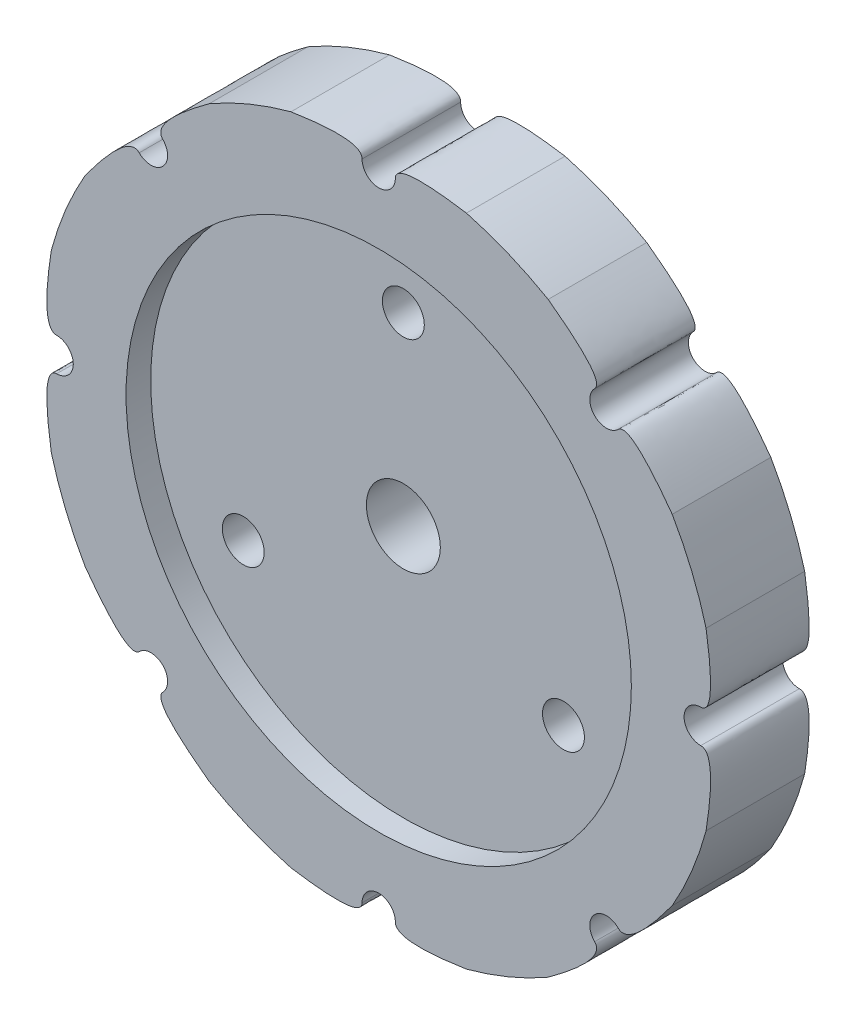
from build123d import *

# Parameters (mm, degrees)
ESQUISSE1_R                   = 27.5
BOSS_EXTRU_1_DEPTH            = 4
ENL_V_MAT_EXTRU_1_DEPTH       = 40.096035605
R_P_TITION_CIRCULAIRE1_COUNT  = 8
DIAM_TRE_DU_PER_AGE_6_0_6_1_D = 6
D_GAGEMENT_M31_D              = 3.4
ESQUISSE9_R                   = 20.5
ENL_V_MAT_EXTRU_2_DEPTH       = 2


with BuildPart() as part:
    # Esquisse1 → Boss.-Extru.1 (new, symmetric)
    with BuildSketch(Plane.XY):
        Circle(ESQUISSE1_R)
    extrude(amount=BOSS_EXTRU_1_DEPTH, both=True)

    # Esquisse2 → Enlèv. mat.-Extru.1 (cut, symmetric)
    with BuildSketch(Plane.XY):
        with BuildLine():
            ThreePointArc((7.11752374, 26.562960223), (0, 27.5), (-7.11752374, 26.562960223))
            add(Edge.make_bspline(
                [(-1.35, 26.131259298), (-1.35, 27.466843648), (-7.11752374, 26.562960223)],
                knots=[0, 0, 0, 1, 1, 1], degree=2))
            ThreePointArc((-1.35, 26.131259298), (0, 24.781259298), (1.35, 26.131259298))
            add(Edge.make_bspline(
                [(1.35, 26.131259298), (1.35, 27.466843648), (7.11752374, 26.562960223)],
                knots=[0, 0, 0, 1, 1, 1], degree=2))
        make_face()
    enl_v_mat_extru_1 = extrude(amount=ENL_V_MAT_EXTRU_1_DEPTH, both=True, mode=Mode.SUBTRACT)

    # Répétition circulaire1: Enlèv. mat.-Extru.1 ×8 about axis
    r_p_tition_circulaire1_axis = Axis((0, 0, 4), (0, 0, -1))
    for i in range(1, R_P_TITION_CIRCULAIRE1_COUNT):
        add(enl_v_mat_extru_1.rotate(r_p_tition_circulaire1_axis, i * 360 / R_P_TITION_CIRCULAIRE1_COUNT), mode=Mode.SUBTRACT)

    # Diamètre du perçage Ø6.0 (6)1 (through all)
    with Locations(Plane.XY.offset(4)):
        with Locations((0, 0)):
            Hole(DIAM_TRE_DU_PER_AGE_6_0_6_1_D / 2)

    # Dégagement M31 (through all)
    with Locations(Plane.XY.offset(4)):
        with Locations((0, 15), (-12.990381057, -7.5), (12.990381057, -7.5)):
            Hole(D_GAGEMENT_M31_D / 2)

    # Esquisse9 → Enlèv. mat.-Extru.2 (cut)
    with BuildSketch(Plane.XY.offset(4)):
        Circle(ESQUISSE9_R)
    extrude(amount=-ENL_V_MAT_EXTRU_2_DEPTH, mode=Mode.SUBTRACT)


solid = part.part
